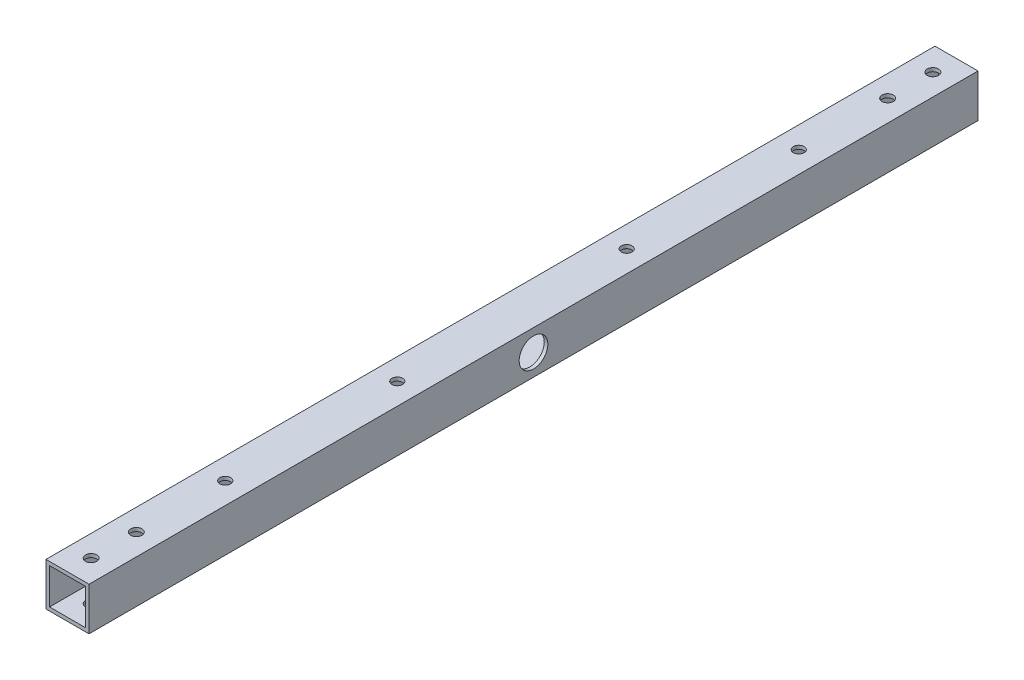
from build123d import *

# Parameters (mm, degrees)
SKETCH1_W               = 19.05
SKETCH1_H               = 19.05
SKETCH1_W_2             = 15.875
SKETCH1_H_2             = 15.875
BOSS_EXTRUDE1_DEPTH     = 196.85
CUT_EXTRUDE1_DEPTH      = 198.310348816
CUT_EXTRUDE1_DEPTH_BACK = 198.310348816
SKETCH2_R               = 6.35
SKETCH3_R               = 2.5
CUT_EXTRUDE2_DEPTH      = 30
SKETCH4_R               = 2.38125
CUT_EXTRUDE3_DEPTH      = 30


with BuildPart() as part:
    # Sketch1 → Boss-Extrude1 (new, symmetric)
    with BuildSketch(Plane.XY):
        Rectangle(SKETCH1_W, SKETCH1_H)
        Rectangle(SKETCH1_W_2, SKETCH1_H_2, mode=Mode.SUBTRACT)
    extrude(amount=BOSS_EXTRUDE1_DEPTH, both=True)

    # Sketch2 → Cut-Extrude1 (cut, two sides: drawn at the far end of the back side and taken through both)
    with BuildSketch(Plane(origin=(0, 0, 0), x_dir=(0, 0, -1), z_dir=(1, 0, 0)).offset(-CUT_EXTRUDE1_DEPTH_BACK)):
        Circle(SKETCH2_R)
    extrude(amount=CUT_EXTRUDE1_DEPTH + CUT_EXTRUDE1_DEPTH_BACK, mode=Mode.SUBTRACT)

    # Sketch3 → Cut-Extrude2 (cut)
    with BuildSketch(Plane(origin=(-152.4, 13.525, 0), x_dir=(1, 0, 0), z_dir=(0, 1, 0))):
        with Locations(Location((152.4, -186.375, 0), (0, 0, 270))):
            Circle(SKETCH3_R)
        with Locations(Location((152.4, -166.375, 0), (0, 0, 270))):
            Circle(SKETCH3_R)
    cut_extrude2 = extrude(amount=-CUT_EXTRUDE2_DEPTH, mode=Mode.SUBTRACT)

    # Mirror1: Cut-Extrude2 across Front Plane
    add(cut_extrude2.mirror(Plane.XY), mode=Mode.SUBTRACT)

    # Sketch4 → Cut-Extrude3 (cut)
    with BuildSketch(Plane(origin=(-152.4, 18.1864, 0), x_dir=(1, 0, 0), z_dir=(0, 1, 0))):
        with Locations(Location((152.4, -127, 0), (0, 0, 270))):
            Circle(SKETCH4_R)
        with Locations(Location((152.4, 127, 0), (0, 0, 270))):
            Circle(SKETCH4_R)
        with Locations(Location((152.4, -50.8, 0), (0, 0, 270))):
            Circle(SKETCH4_R)
        with Locations(Location((152.4, 50.8, 0), (0, 0, 270))):
            Circle(SKETCH4_R)
    extrude(amount=-CUT_EXTRUDE3_DEPTH, mode=Mode.SUBTRACT)


solid = part.part
